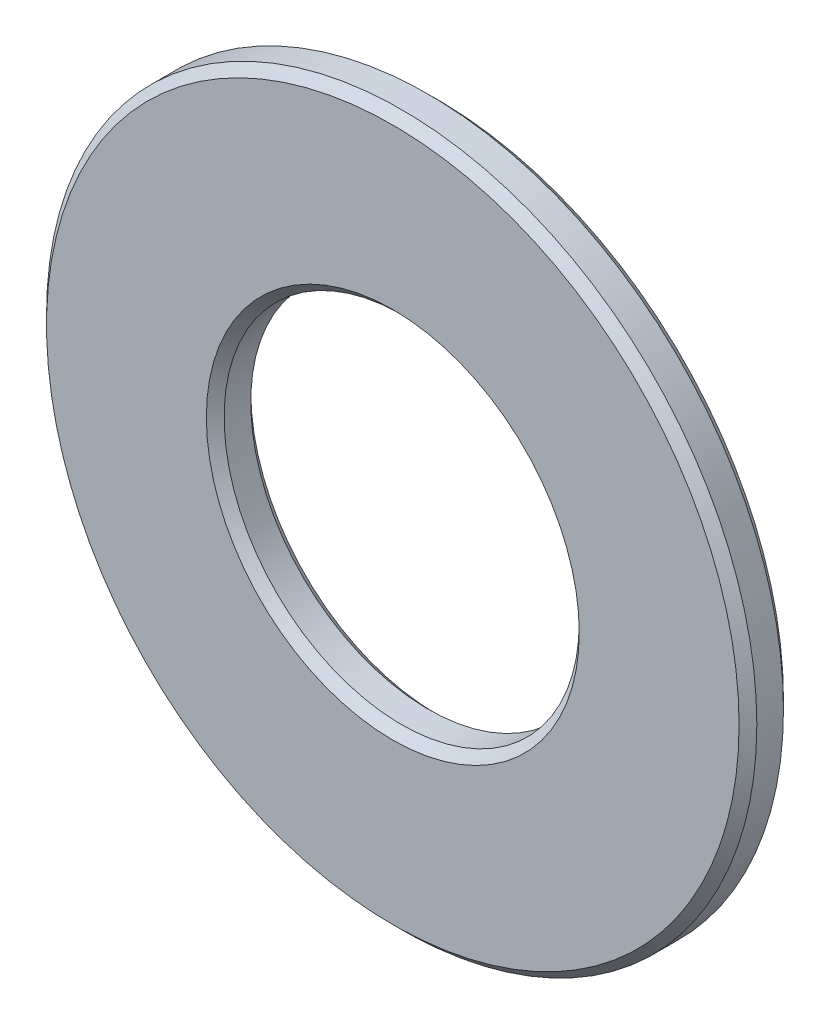
from build123d import *

# Parameters (mm, degrees)
SKETCH_1_R      = 4
SKETCH_1_R_2    = 2
EXTRUDE_1_DEPTH = 0.25
CHAMFER_1_SIZE  = 0.1


with BuildPart() as part:
    # 草图1 → 凸台-拉伸1 (new, symmetric)
    with BuildSketch(Plane.XY):
        Circle(SKETCH_1_R)
        Circle(SKETCH_1_R_2, mode=Mode.SUBTRACT)
    extrude(amount=EXTRUDE_1_DEPTH, both=True)

    # 倒角1
    chamfer_1_edges = [part.edges().sort_by_distance(p)[0] for p in [
        (-4, 0, -0.25),
        (-4, 0, 0.25),
        (-2, 0, -0.25),
        (-2, 0, 0.25),
    ]]
    chamfer(chamfer_1_edges, length=CHAMFER_1_SIZE)


solid = part.part
